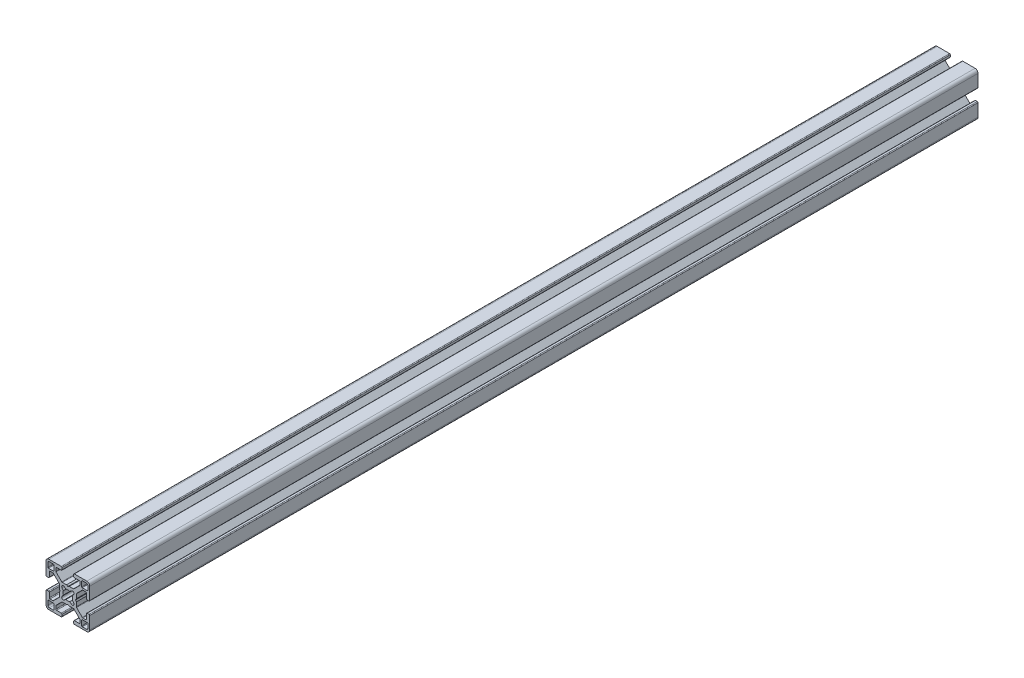
from build123d import *

# Parameters (mm, degrees)
BOSS_EXTRUDE1_DEPTH = 609.6


with BuildPart() as part:
    # Sketch1 → Boss-Extrude1 (new body)
    with BuildSketch(Plane(origin=(0, 0, -25), x_dir=(-1, 0, 0), z_dir=(0, 0, -1))):
        with BuildLine():
            Line((15, -13), (15, -4.508))
            ThreePointArc((15, -4.508), (14.851210245, -4.148789755), (14.492, -4))
            Line((14.492, -4), (13.251, -4))
            ThreePointArc((13.251, -4), (12.891789755, -4.148789755), (12.743, -4.508))
            Line((12.743, -4.508), (12.743, -7.742))
            ThreePointArc((12.743, -7.742), (12.594210245, -8.101210245), (12.235, -8.25))
            Line((12.235, -8.25), (10.26292049, -8.25))
            ThreePointArc((10.26292049, -8.25), (10.068517306, -8.211330803), (9.903710245, -8.101210245))
            Line((9.903710245, -8.101210245), (5.983289755, -4.180789755))
            ThreePointArc((5.983289755, -4.180789755), (5.873169197, -4.015982694), (5.8345, -3.82157951))
            Line((5.8345, -3.82157951), (5.8345, -0.949019985))
            Line((5.8345, -0.949019985), (5.325, 0))
            Line((5.325, 0), (5.8345, 0.949019985))
            Line((5.8345, 0.949019985), (5.8345, 3.820334926))
            ThreePointArc((5.8345, 3.820334926), (5.873169197, 4.01473811), (5.983289755, 4.179545171))
            Line((5.983289755, 4.179545171), (9.904954829, 8.101210245))
            ThreePointArc((9.904954829, 8.101210245), (10.06976189, 8.211330803), (10.264165074, 8.25))
            Line((10.264165074, 8.25), (12.235, 8.25))
            ThreePointArc((12.235, 8.25), (12.594210245, 8.101210245), (12.743, 7.742))
            Line((12.743, 7.742), (12.743, 4.508))
            ThreePointArc((12.743, 4.508), (12.891789755, 4.148789755), (13.251, 4))
            Line((13.251, 4), (14.492, 4))
            ThreePointArc((14.492, 4), (14.851210245, 4.148789755), (15, 4.508))
            Line((15, 4.508), (15, 13))
            ThreePointArc((15, 13), (14.414213562, 14.414213562), (13, 15))
            Line((13, 15), (4.508, 15))
            ThreePointArc((4.508, 15), (4.148789755, 14.851210245), (4, 14.492))
            Line((4, 14.492), (4, 13.251))
            ThreePointArc((4, 13.251), (4.148789755, 12.891789755), (4.508, 12.743))
            Line((4.508, 12.743), (7.742, 12.743))
            ThreePointArc((7.742, 12.743), (8.101210245, 12.594210245), (8.25, 12.235))
            Line((8.25, 12.235), (8.25, 10.26292049))
            ThreePointArc((8.25, 10.26292049), (8.211330803, 10.068517306), (8.101210245, 9.903710245))
            Line((8.101210245, 9.903710245), (4.180789755, 5.983289755))
            ThreePointArc((4.180789755, 5.983289755), (4.015982694, 5.873169197), (3.82157951, 5.8345))
            Line((3.82157951, 5.8345), (0.949019985, 5.8345))
            Line((0.949019985, 5.8345), (0, 5.325))
            Line((0, 5.325), (-0.949019985, 5.8345))
            Line((-0.949019985, 5.8345), (-3.820334926, 5.8345))
            ThreePointArc((-3.820334926, 5.8345), (-4.01473811, 5.873169197), (-4.179545171, 5.983289755))
            Line((-4.179545171, 5.983289755), (-8.101210245, 9.904954829))
            ThreePointArc((-8.101210245, 9.904954829), (-8.211330803, 10.06976189), (-8.25, 10.264165074))
            Line((-8.25, 10.264165074), (-8.25, 12.235))
            ThreePointArc((-8.25, 12.235), (-8.101210245, 12.594210245), (-7.742, 12.743))
            Line((-7.742, 12.743), (-4.508, 12.743))
            ThreePointArc((-4.508, 12.743), (-4.148789755, 12.891789755), (-4, 13.251))
            Line((-4, 13.251), (-4, 14.492))
            ThreePointArc((-4, 14.492), (-4.148789755, 14.851210245), (-4.508, 15))
            Line((-4.508, 15), (-13, 15))
            ThreePointArc((-13, 15), (-14.414213562, 14.414213562), (-15, 13))
            Line((-15, 13), (-15, 4.508))
            ThreePointArc((-15, 4.508), (-14.851210245, 4.148789755), (-14.492, 4))
            Line((-14.492, 4), (-13.251, 4))
            ThreePointArc((-13.251, 4), (-12.891789755, 4.148789755), (-12.743, 4.508))
            Line((-12.743, 4.508), (-12.743, 7.742))
            ThreePointArc((-12.743, 7.742), (-12.594210245, 8.101210245), (-12.235, 8.25))
            Line((-12.235, 8.25), (-10.26292049, 8.25))
            ThreePointArc((-10.26292049, 8.25), (-10.068517306, 8.211330803), (-9.903710245, 8.101210245))
            Line((-9.903710245, 8.101210245), (-5.983289755, 4.180789755))
            ThreePointArc((-5.983289755, 4.180789755), (-5.873169197, 4.015982694), (-5.8345, 3.82157951))
            Line((-5.8345, 3.82157951), (-5.8345, 0.949019985))
            Line((-5.8345, 0.949019985), (-5.325, 0))
            Line((-5.325, 0), (-5.8345, -0.949019985))
            Line((-5.8345, -0.949019985), (-5.8345, -3.820334926))
            ThreePointArc((-5.8345, -3.820334926), (-5.873169197, -4.01473811), (-5.983289755, -4.179545171))
            Line((-5.983289755, -4.179545171), (-9.904954829, -8.101210245))
            ThreePointArc((-9.904954829, -8.101210245), (-10.06976189, -8.211330803), (-10.264165074, -8.25))
            Line((-10.264165074, -8.25), (-12.235, -8.25))
            ThreePointArc((-12.235, -8.25), (-12.594210245, -8.101210245), (-12.743, -7.742))
            Line((-12.743, -7.742), (-12.743, -4.508))
            ThreePointArc((-12.743, -4.508), (-12.891789755, -4.148789755), (-13.251, -4))
            Line((-13.251, -4), (-14.492, -4))
            ThreePointArc((-14.492, -4), (-14.851210245, -4.148789755), (-15, -4.508))
            Line((-15, -4.508), (-15, -13))
            ThreePointArc((-15, -13), (-14.414213562, -14.414213562), (-13, -15))
            Line((-13, -15), (-4.508, -15))
            ThreePointArc((-4.508, -15), (-4.148789755, -14.851210245), (-4, -14.492))
            Line((-4, -14.492), (-4, -13.251))
            ThreePointArc((-4, -13.251), (-4.148789755, -12.891789755), (-4.508, -12.743))
            Line((-4.508, -12.743), (-7.742, -12.743))
            ThreePointArc((-7.742, -12.743), (-8.101210245, -12.594210245), (-8.25, -12.235))
            Line((-8.25, -12.235), (-8.25, -10.26292049))
            ThreePointArc((-8.25, -10.26292049), (-8.211330803, -10.068517306), (-8.101210245, -9.903710245))
            Line((-8.101210245, -9.903710245), (-4.180789755, -5.983289755))
            ThreePointArc((-4.180789755, -5.983289755), (-4.015982694, -5.873169197), (-3.82157951, -5.8345))
            Line((-3.82157951, -5.8345), (-0.949019985, -5.8345))
            Line((-0.949019985, -5.8345), (0, -5.325))
            Line((0, -5.325), (0.949019985, -5.8345))
            Line((0.949019985, -5.8345), (3.820334926, -5.8345))
            ThreePointArc((3.820334926, -5.8345), (4.01473811, -5.873169197), (4.179545171, -5.983289755))
            Line((4.179545171, -5.983289755), (8.101210245, -9.904954829))
            ThreePointArc((8.101210245, -9.904954829), (8.211330803, -10.06976189), (8.25, -10.264165074))
            Line((8.25, -10.264165074), (8.25, -12.235))
            ThreePointArc((8.25, -12.235), (8.101210245, -12.594210245), (7.742, -12.743))
            Line((7.742, -12.743), (4.508, -12.743))
            ThreePointArc((4.508, -12.743), (4.148789755, -12.891789755), (4, -13.251))
            Line((4, -13.251), (4, -14.492))
            ThreePointArc((4, -14.492), (4.148789755, -14.851210245), (4.508, -15))
            Line((4.508, -15), (13, -15))
            ThreePointArc((13, -15), (14.414213562, -14.414213562), (15, -13))
        make_face()
        with BuildLine():
            Line((13.7, -9.881), (13.7, -12.7))
            ThreePointArc((13.7, -12.7), (13.407106781, -13.407106781), (12.7, -13.7))
            Line((12.7, -13.7), (9.881, -13.7))
            ThreePointArc((9.881, -13.7), (9.611592316, -13.588407684), (9.5, -13.319))
            Line((9.5, -13.319), (9.5, -9.881))
            ThreePointArc((9.5, -9.881), (9.611592316, -9.611592316), (9.881, -9.5))
            Line((9.881, -9.5), (13.319, -9.5))
            ThreePointArc((13.319, -9.5), (13.588407684, -9.611592316), (13.7, -9.881))
        make_face(mode=Mode.SUBTRACT)
        with BuildLine():
            Line((13.7, 12.7), (13.7, 9.881))
            ThreePointArc((13.7, 9.881), (13.588407684, 9.611592316), (13.319, 9.5))
            Line((13.319, 9.5), (9.881, 9.5))
            ThreePointArc((9.881, 9.5), (9.611592316, 9.611592316), (9.5, 9.881))
            Line((9.5, 9.881), (9.5, 13.319))
            ThreePointArc((9.5, 13.319), (9.611592316, 13.588407684), (9.881, 13.7))
            Line((9.881, 13.7), (12.7, 13.7))
            ThreePointArc((12.7, 13.7), (13.407106781, 13.407106781), (13.7, 12.7))
        make_face(mode=Mode.SUBTRACT)
        with BuildLine():
            Line((3.054422686, -1.313821545), (4.010726841, -2.5139095))
            ThreePointArc((4.010726841, -2.5139095), (3.900018469, -3.900018469), (2.5139095, -4.010726841))
            Line((2.5139095, -4.010726841), (1.313821545, -3.054422686))
            ThreePointArc((1.313821545, -3.054422686), (0, -3.325), (-1.313821545, -3.054422686))
            Line((-1.313821545, -3.054422686), (-2.5139095, -4.010726841))
            ThreePointArc((-2.5139095, -4.010726841), (-3.900018469, -3.900018469), (-4.010726841, -2.5139095))
            Line((-4.010726841, -2.5139095), (-3.054422686, -1.313821545))
            ThreePointArc((-3.054422686, -1.313821545), (-3.325, 0), (-3.054422686, 1.313821545))
            Line((-3.054422686, 1.313821545), (-4.010726841, 2.5139095))
            ThreePointArc((-4.010726841, 2.5139095), (-3.900018469, 3.900018469), (-2.5139095, 4.010726841))
            Line((-2.5139095, 4.010726841), (-1.313821545, 3.054422686))
            ThreePointArc((-1.313821545, 3.054422686), (0, 3.325), (1.313821545, 3.054422686))
            Line((1.313821545, 3.054422686), (2.5139095, 4.010726841))
            ThreePointArc((2.5139095, 4.010726841), (3.900018469, 3.900018469), (4.010726841, 2.5139095))
            Line((4.010726841, 2.5139095), (3.054422686, 1.313821545))
            ThreePointArc((3.054422686, 1.313821545), (3.325, 0), (3.054422686, -1.313821545))
        make_face(mode=Mode.SUBTRACT)
        with BuildLine():
            Line((-9.5, 13.319), (-9.5, 9.881))
            ThreePointArc((-9.5, 9.881), (-9.611592316, 9.611592316), (-9.881, 9.5))
            Line((-9.881, 9.5), (-13.319, 9.5))
            ThreePointArc((-13.319, 9.5), (-13.588407684, 9.611592316), (-13.7, 9.881))
            Line((-13.7, 9.881), (-13.7, 12.7))
            ThreePointArc((-13.7, 12.7), (-13.407106781, 13.407106781), (-12.7, 13.7))
            Line((-12.7, 13.7), (-9.881, 13.7))
            ThreePointArc((-9.881, 13.7), (-9.611592316, 13.588407684), (-9.5, 13.319))
        make_face(mode=Mode.SUBTRACT)
        with BuildLine():
            Line((-9.5, -9.881), (-9.5, -13.319))
            ThreePointArc((-9.5, -13.319), (-9.611592316, -13.588407684), (-9.881, -13.7))
            Line((-9.881, -13.7), (-12.7, -13.7))
            ThreePointArc((-12.7, -13.7), (-13.407106781, -13.407106781), (-13.7, -12.7))
            Line((-13.7, -12.7), (-13.7, -9.881))
            ThreePointArc((-13.7, -9.881), (-13.588407684, -9.611592316), (-13.319, -9.5))
            Line((-13.319, -9.5), (-9.881, -9.5))
            ThreePointArc((-9.881, -9.5), (-9.611592316, -9.611592316), (-9.5, -9.881))
        make_face(mode=Mode.SUBTRACT)
    extrude(amount=-BOSS_EXTRUDE1_DEPTH)


solid = part.part
